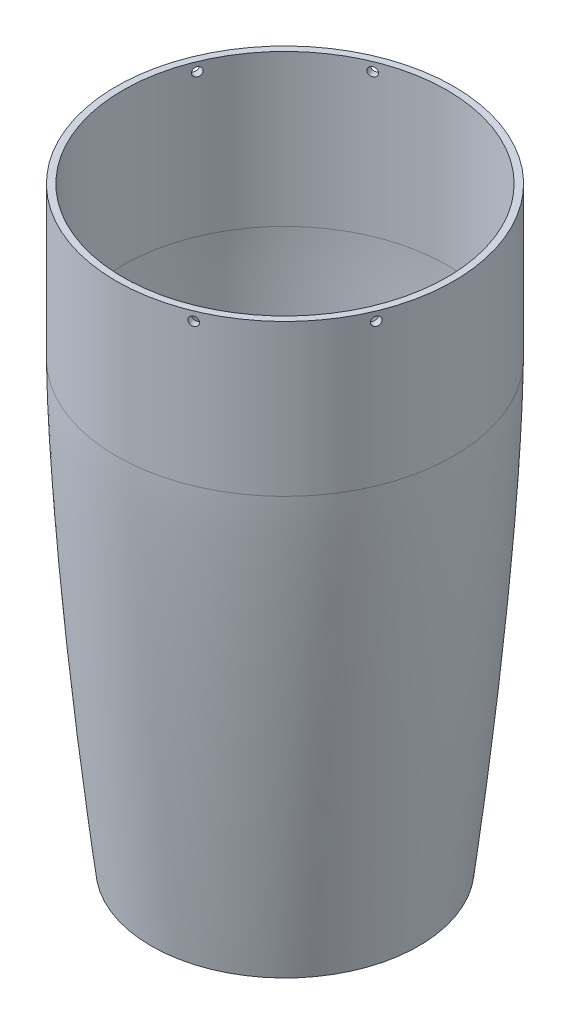
from build123d import *

# Parameters (mm, degrees)
SKETCH4_R          = 2
CUT_EXTRUDE1_DEPTH = 598.137418243
SKETCH5_R          = 2
CUT_EXTRUDE2_DEPTH = 597.095224503
SKETCH6_R          = 2
CUT_EXTRUDE3_DEPTH = 597.095224503


with BuildPart() as part:
    # Sketch1 → Revolve2 (revolve)
    with BuildSketch(Plane.XY, mode=Mode.PRIVATE) as revolve2_sk:
        with BuildLine():
            Line((57.272319057, 300.990034), (60.272319057, 300.990034))
            add(Edge.make_bspline(
                [(60.272319057, 300.990034), (60.786580015, 305.295203792), (62.216459446, 317.463391064), (64.020877786, 333.572779096), (66.11894295, 353.631593101), (68.030132581, 373.329466343), (69.466784443, 389.09643856), (70.806129018, 404.87199461), (71.886996993, 418.683052253), (72.742662769, 430.526418849), (73.404435972, 440.399441684), (73.901071328, 448.299980017), (74.304775576, 455.214817724), (74.62677953, 461.143160456), (74.877801518, 466.084350078), (75.067577987, 470.037846817), (75.336303636, 476.005510657), (75.563352259, 481.736537174), (75.748085722, 487.230769759), (75.884662604, 492.488061525), (75.940348523, 495.116996281), (75.978043797, 497.370577281), (75.993594118, 498.87307617), (76, 499.624354134), (76, 500)],
                knots=[0.606633708, 0.606633708, 0.606633708, 0.606633708, 0.606633708, 0.640794795, 0.703164955, 0.734350023, 0.765535092, 0.796720055, 0.827905019, 0.859090157, 0.874682727, 0.890275296, 0.905867787, 0.921460278, 0.929256523, 0.937052769, 0.944849014, 0.95264526, 0.97632263, 0.982241972, 0.988161315, 0.994080657, 0.997040329, 1, 1, 1, 1, 1], degree=4))
            Line((76, 500), (76, 568.250034))
            Line((76, 568.250034), (73, 568.250034))
            Line((73, 568.250034), (73, 500))
            add(Edge.make_bspline(
                [(73, 500), (73, 499.624354134), (72.993594118, 498.87307617), (72.978043797, 497.370577281), (72.940348523, 495.116996281), (72.884662604, 492.488061525), (72.748085722, 487.230769759), (72.563352259, 481.736537174), (72.336303636, 476.005510657), (72.067577987, 470.037846817), (71.877801518, 466.084350078), (71.62677953, 461.143160456), (71.304775576, 455.214817724), (70.901071328, 448.299980017), (70.404435972, 440.399441684), (69.742662769, 430.526418849), (68.886996993, 418.683052253), (67.806129018, 404.87199461), (66.466784443, 389.09643856), (65.030132581, 373.329466343), (63.11894295, 353.631593101), (61.020877786, 333.572779096), (59.216459446, 317.463391064), (57.786580015, 305.295203792), (57.272319057, 300.990034)],
                knots=[0.636380793, 0.636380793, 0.636380793, 0.636380793, 0.636380793, 0.639340464, 0.642300135, 0.648219478, 0.654138821, 0.660058163, 0.683735533, 0.691531779, 0.699328024, 0.70712427, 0.714920515, 0.730513006, 0.746105497, 0.761698066, 0.777290636, 0.808475774, 0.839660738, 0.870845701, 0.90203077, 0.933215838, 0.995585998, 1.029747085, 1.029747085, 1.029747085, 1.029747085, 1.029747085], degree=4))
        make_face()
    revolve(revolve2_sk.sketch.rotate(Axis((0, 0, 0), (0, 1, 0)), 90), axis=Axis((0, 0, 0), (0, 1, 0)))

    # Sketch4 → Cut-Extrude1 (cut, through all)
    with BuildSketch(Plane(origin=(-53.74011537, 0, 53.74011537), x_dir=(0.7071067811865517, 0, 0.7071067811865435), z_dir=(-0.7071067811865435, 0, 0.7071067811865517))):
        with Locations((0, 564.250034)):
            Circle(SKETCH4_R)
    extrude(amount=-CUT_EXTRUDE1_DEPTH, mode=Mode.SUBTRACT)

    # Sketch5 → Cut-Extrude2 (cut, through all)
    with BuildSketch(Plane(origin=(-70.214844471, 0, -29.08394086), x_dir=(-0.3826834323650874, 0, 0.9238795325112878), z_dir=(-0.9238795325112878, 0, -0.3826834323650874))):
        with Locations((0, 564.250034)):
            Circle(SKETCH5_R)
    extrude(amount=-CUT_EXTRUDE2_DEPTH, mode=Mode.SUBTRACT)

    # Sketch6 → Cut-Extrude3 (cut, through all)
    with BuildSketch(Plane(origin=(-29.08394086, 0, -70.214844471), x_dir=(-0.9238795325112864, 0, 0.38268343236509067), z_dir=(-0.38268343236509067, 0, -0.9238795325112864))):
        with Locations((0, 564.250034)):
            Circle(SKETCH6_R)
    extrude(amount=-CUT_EXTRUDE3_DEPTH, mode=Mode.SUBTRACT)


solid = part.part
